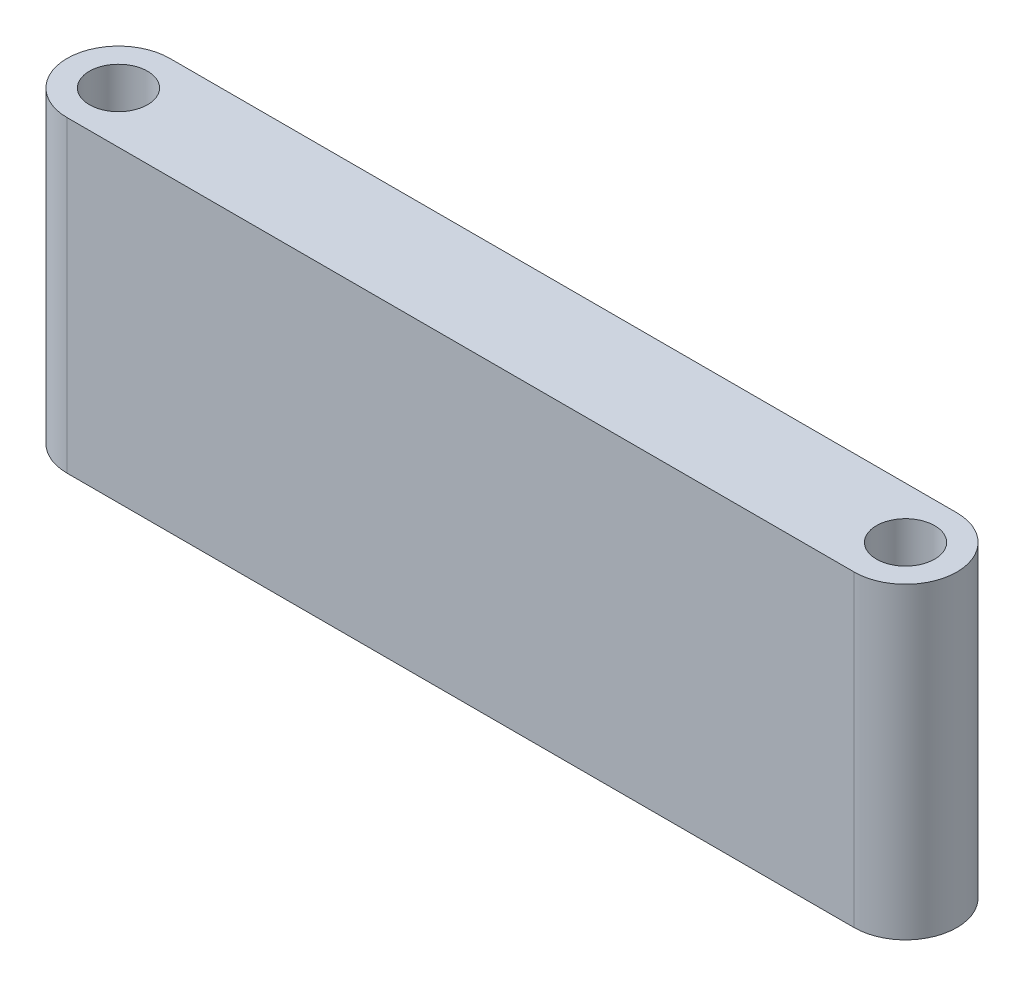
from build123d import *

# Parameters (mm, degrees)
SKETCH_1_R      = 1.7
EXTRUDE_1_DEPTH = 18


with BuildPart() as part:
    # 草图1 → 凸台-拉伸1 (new body)
    with BuildSketch(Plane(origin=(0, 0, 0), x_dir=(1, 0, 0), z_dir=(0, 1, 0))):
        with BuildLine():
            Line((-23, 3), (23, 3))
            ThreePointArc((23, 3), (26, 0), (23, -3))
            Line((23, -3), (-23, -3))
            ThreePointArc((-23, -3), (-26, 0), (-23, 3))
        make_face()
        with Locations(Location((23, 0, 0), (0, 0, 270))):
            Circle(SKETCH_1_R, mode=Mode.SUBTRACT)
        with Locations(Location((-23, 0, 0), (0, 0, 270))):
            Circle(SKETCH_1_R, mode=Mode.SUBTRACT)
    extrude(amount=EXTRUDE_1_DEPTH)


solid = part.part
